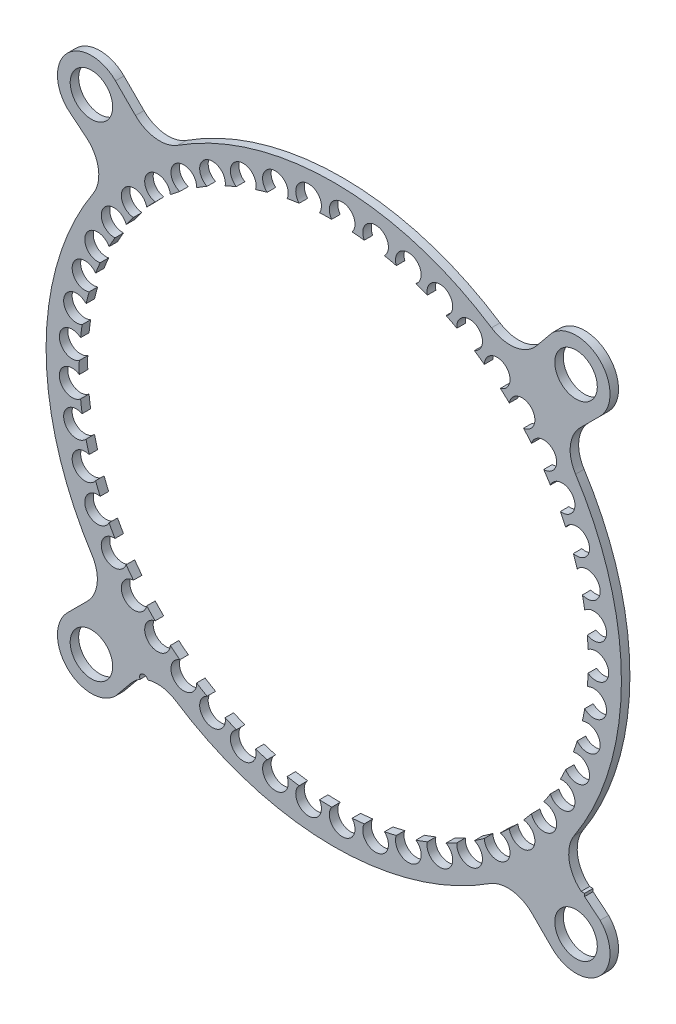
from build123d import *

# Parameters (mm, degrees)
SKETCH_1_R          = 1.51
SKETCH_1_R_2        = 26.499999999
SKETCH_1_R_3        = 2.5
EXTRUDE_1_DEPTH     = 1
SKETCH_2_R          = 0.5
CUT_EXTRUDE_1_DEPTH = 10
SKETCH_3_R          = 29.940822837
CUT_EXTRUDE_2_DEPTH = 10


with BuildPart() as part:
    # 草图1 → 凸台-拉伸1 (new body)
    with BuildSketch(Plane.XY):
        with BuildLine():
            Line((29.100721778, -23.408930549), (29.502331969, -23.408930549))
            Line((29.502331969, -23.408930549), (29.502331969, -23.738022939))
            Line((29.502331969, -23.738022939), (31.328174592, -25.234177486))
            ThreePointArc((31.328174592, -25.234177486), (31.328174592, -30.891031735), (25.671320342, -30.891031735))
            Line((25.671320342, -30.891031735), (23.320064465, -28.539775858))
            ThreePointArc((23.320064465, -28.539775858), (20.916937037, -27.390877227), (18.325216054, -28.005671376))
            ThreePointArc((18.325216054, -28.005671376), (-0.138932734, -33.397571899), (-18.558178986, -27.854220096))
            ThreePointArc((-18.558178986, -27.854220096), (-21.357328746, -27.244893526), (-23.846073408, -28.663578922))
            Line((-23.846073408, -28.663578922), (-25.671320345, -30.891031735))
            ThreePointArc((-25.671320345, -30.891031735), (-31.328174595, -30.891031735), (-31.328174595, -25.234177486))
            Line((-31.328174595, -25.234177486), (-28.976918718, -22.882921609))
            ThreePointArc((-28.976918718, -22.882921609), (-27.828020086, -20.479794181), (-28.442814235, -17.888073198))
            ThreePointArc((-28.442814235, -17.888073198), (-33.834714759, 0.57607559), (-28.291362955, 18.995321842))
            ThreePointArc((-28.291362955, 18.995321842), (-27.682036385, 21.794471602), (-29.100721781, 24.283216264))
            Line((-29.100721781, 24.283216264), (-31.328174595, 26.108463201))
            ThreePointArc((-31.328174595, 26.108463201), (-31.328174595, 31.765317451), (-25.671320345, 31.765317451))
            Line((-25.671320345, 31.765317451), (-23.320064468, 29.414061574))
            ThreePointArc((-23.320064468, 29.414061574), (-20.91693704, 28.265162943), (-18.325216057, 28.879957091))
            ThreePointArc((-18.325216057, 28.879957091), (0.138932731, 34.271857615), (18.558178983, 28.728505811))
            ThreePointArc((18.558178983, 28.728505811), (21.357328743, 28.119179242), (23.846073405, 29.537864637))
            Line((23.846073405, 29.537864637), (25.671320342, 31.765317451))
            ThreePointArc((25.671320342, 31.765317451), (31.328174592, 31.765317451), (31.328174592, 26.108463201))
            Line((31.328174592, 26.108463201), (28.976918715, 23.757207324))
            ThreePointArc((28.976918715, 23.757207324), (27.828020083, 21.354079896), (28.442814232, 18.762358913))
            ThreePointArc((28.442814232, 18.762358913), (33.834714756, 0.298210125), (28.291362952, -18.121036127))
            ThreePointArc((28.291362952, -18.121036127), (27.682036382, -20.920185887), (29.100721778, -23.408930549))
        make_face()
        with Locations((15.98204288, -25.926908525)):
            Circle(SKETCH_1_R, mode=Mode.SUBTRACT)
        with Locations((12.479470468, -27.754198309)):
            Circle(SKETCH_1_R, mode=Mode.SUBTRACT)
        with Locations((8.771985495, -29.118587051)):
            Circle(SKETCH_1_R, mode=Mode.SUBTRACT)
        with Locations((4.920464764, -29.997671524)):
            Circle(SKETCH_1_R, mode=Mode.SUBTRACT)
        with Locations((0.988150136, -30.377017187)):
            Circle(SKETCH_1_R, mode=Mode.SUBTRACT)
        with Locations((-2.960389889, -30.250395194)):
            Circle(SKETCH_1_R, mode=Mode.SUBTRACT)
        with Locations((-6.860320394, -29.619884674)):
            Circle(SKETCH_1_R, mode=Mode.SUBTRACT)
        with Locations((19.22219059, -23.666721746)):
            Circle(SKETCH_1_R, mode=Mode.SUBTRACT)
        with Locations((-10.647604627, -28.495838593)):
            Circle(SKETCH_1_R, mode=Mode.SUBTRACT)
        with Locations((-14.260055487, -26.896713757)):
            Circle(SKETCH_1_R, mode=Mode.SUBTRACT)
        with Locations((-17.638356631, -24.848767751)):
            Circle(SKETCH_1_R, mode=Mode.SUBTRACT)
        with Locations((-20.727036446, -22.385627792)):
            Circle(SKETCH_1_R, mode=Mode.SUBTRACT)
        with Locations((-23.475378895, -19.547738569)):
            Circle(SKETCH_1_R, mode=Mode.SUBTRACT)
        with Locations((-25.838256273, -16.381698146)):
            Circle(SKETCH_1_R, mode=Mode.SUBTRACT)
        with Locations((-27.776870196, -12.939492819)):
            Circle(SKETCH_1_R, mode=Mode.SUBTRACT)
        with Locations((-29.259388679, -9.277643504)):
            Circle(SKETCH_1_R, mode=Mode.SUBTRACT)
        with Locations((-30.261468809, -5.456277665)):
            Circle(SKETCH_1_R, mode=Mode.SUBTRACT)
        with Locations((-30.766656457, -1.538142025)):
            Circle(SKETCH_1_R, mode=Mode.SUBTRACT)
        with Locations((-30.766656457, 2.412427739)):
            Circle(SKETCH_1_R, mode=Mode.SUBTRACT)
        with Locations((-30.261468809, 6.33056338)):
            Circle(SKETCH_1_R, mode=Mode.SUBTRACT)
        with Locations((-29.259388679, 10.151929218)):
            Circle(SKETCH_1_R, mode=Mode.SUBTRACT)
        with Locations((-27.776870196, 13.813778533)):
            Circle(SKETCH_1_R, mode=Mode.SUBTRACT)
        with Locations((-25.838256273, 17.255983861)):
            Circle(SKETCH_1_R, mode=Mode.SUBTRACT)
        with Locations((-23.475378895, 20.422024284)):
            Circle(SKETCH_1_R, mode=Mode.SUBTRACT)
        with Locations((-20.727036446, 23.259913506)):
            Circle(SKETCH_1_R, mode=Mode.SUBTRACT)
        with Locations((-17.638356631, 25.723053465)):
            Circle(SKETCH_1_R, mode=Mode.SUBTRACT)
        with Locations((-14.260055487, 27.770999471)):
            Circle(SKETCH_1_R, mode=Mode.SUBTRACT)
        with Locations((-10.647604627, 29.370124308)):
            Circle(SKETCH_1_R, mode=Mode.SUBTRACT)
        with Locations((-6.860320394, 30.494170388)):
            Circle(SKETCH_1_R, mode=Mode.SUBTRACT)
        with Locations((-2.960389889, 31.124680908)):
            Circle(SKETCH_1_R, mode=Mode.SUBTRACT)
        with Locations((0.988150136, 31.251302901)):
            Circle(SKETCH_1_R, mode=Mode.SUBTRACT)
        with Locations((4.920464764, 30.871957238)):
            Circle(SKETCH_1_R, mode=Mode.SUBTRACT)
        with Locations((8.771985495, 29.992872765)):
            Circle(SKETCH_1_R, mode=Mode.SUBTRACT)
        with Locations((12.479470468, 28.628484023)):
            Circle(SKETCH_1_R, mode=Mode.SUBTRACT)
        with Locations((15.98204288, 26.801194239)):
            Circle(SKETCH_1_R, mode=Mode.SUBTRACT)
        with Locations((19.22219059, 24.54100746)):
            Circle(SKETCH_1_R, mode=Mode.SUBTRACT)
        with Locations((22.146710462, 21.885035891)):
            Circle(SKETCH_1_R, mode=Mode.SUBTRACT)
        with Locations((24.707581961, 18.876890511)):
            Circle(SKETCH_1_R, mode=Mode.SUBTRACT)
        with Locations((26.862755647, 15.565964985)):
            Circle(SKETCH_1_R, mode=Mode.SUBTRACT)
        with Locations((28.576843628, 12.006624617)):
            Circle(SKETCH_1_R, mode=Mode.SUBTRACT)
        with Locations((29.821700626, 8.257313679)):
            Circle(SKETCH_1_R, mode=Mode.SUBTRACT)
        with Locations((30.576886125, 4.379595752)):
            Circle(SKETCH_1_R, mode=Mode.SUBTRACT)
        with Locations((30.829999999, 0.437142857)):
            Circle(SKETCH_1_R, mode=Mode.SUBTRACT)
        with Locations((30.576886125, -3.505310037)):
            Circle(SKETCH_1_R, mode=Mode.SUBTRACT)
        with Locations((29.821700626, -7.383027964)):
            Circle(SKETCH_1_R, mode=Mode.SUBTRACT)
        with Locations((28.576843628, -11.132338903)):
            Circle(SKETCH_1_R, mode=Mode.SUBTRACT)
        with Locations((26.862755647, -14.69167927)):
            Circle(SKETCH_1_R, mode=Mode.SUBTRACT)
        with Locations((24.707581961, -18.002604797)):
            Circle(SKETCH_1_R, mode=Mode.SUBTRACT)
        with Locations((22.146710462, -21.010750177)):
            Circle(SKETCH_1_R, mode=Mode.SUBTRACT)
        with Locations((2e-09, 0.437142854)):
            Circle(SKETCH_1_R_2, mode=Mode.SUBTRACT)
        with Locations((28.499747467, -28.062604611)):
            Circle(SKETCH_1_R_3, mode=Mode.SUBTRACT)
        with Locations((-28.49974747, -28.062604611)):
            Circle(SKETCH_1_R_3, mode=Mode.SUBTRACT)
        with Locations((-28.49974747, 28.936890326)):
            Circle(SKETCH_1_R_3, mode=Mode.SUBTRACT)
        with Locations((28.499747467, 28.936890326)):
            Circle(SKETCH_1_R_3, mode=Mode.SUBTRACT)
    extrude(amount=EXTRUDE_1_DEPTH)

    # 草图2 → 切除-拉伸1 (cut)
    with BuildSketch(Plane.XY.offset(1)):
        with Locations((-22.334496259, -27.525135965)):
            Circle(SKETCH_2_R)
    extrude(amount=-CUT_EXTRUDE_1_DEPTH, mode=Mode.SUBTRACT)

    # 草图3 → 切除-拉伸2 (cut)
    with BuildSketch(Plane(origin=(0, 0, 0), x_dir=(-1, 0, 0), z_dir=(0, 0, -1))):
        with Locations((-2e-09, 0.437142854)):
            Circle(SKETCH_3_R)
    extrude(amount=-CUT_EXTRUDE_2_DEPTH, mode=Mode.SUBTRACT)


solid = part.part
